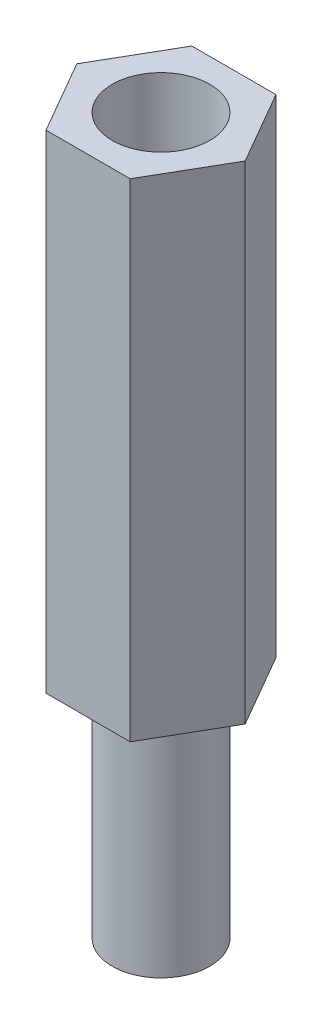
from build123d import *

# Parameters (mm, degrees)
SKETCH1_R           = 1.5
BOSS_EXTRUDE1_DEPTH = 15
SKETCH2_R           = 1.5
BOSS_EXTRUDE3_DEPTH = 7


with BuildPart() as part:
    # Sketch1 → Boss-Extrude1 (new body)
    with BuildSketch(Plane(origin=(0, 0, 0), x_dir=(1, 0, 0), z_dir=(0, 1, 0))):
        Polygon((-1.294560663, 2.242244841), (-2.589121325, 0), (-1.294560663, -2.242244841), (1.294560663, -2.242244841), (2.589121325, 0), (1.294560663, 2.242244841), align=None)
        with Locations(Location((0, 0, 0), (0, 0, 270))):
            Circle(SKETCH1_R, mode=Mode.SUBTRACT)
    extrude(amount=BOSS_EXTRUDE1_DEPTH)


with BuildPart() as body_2:
    # Sketch2 → Boss-Extrude3 (new body)
    with BuildSketch(Plane.XZ):
        with Locations(Location((0, 0, 0), (0, 0, 270))):
            Circle(SKETCH2_R)
    extrude(amount=BOSS_EXTRUDE3_DEPTH)


solid = Compound([part.part, body_2.part])
